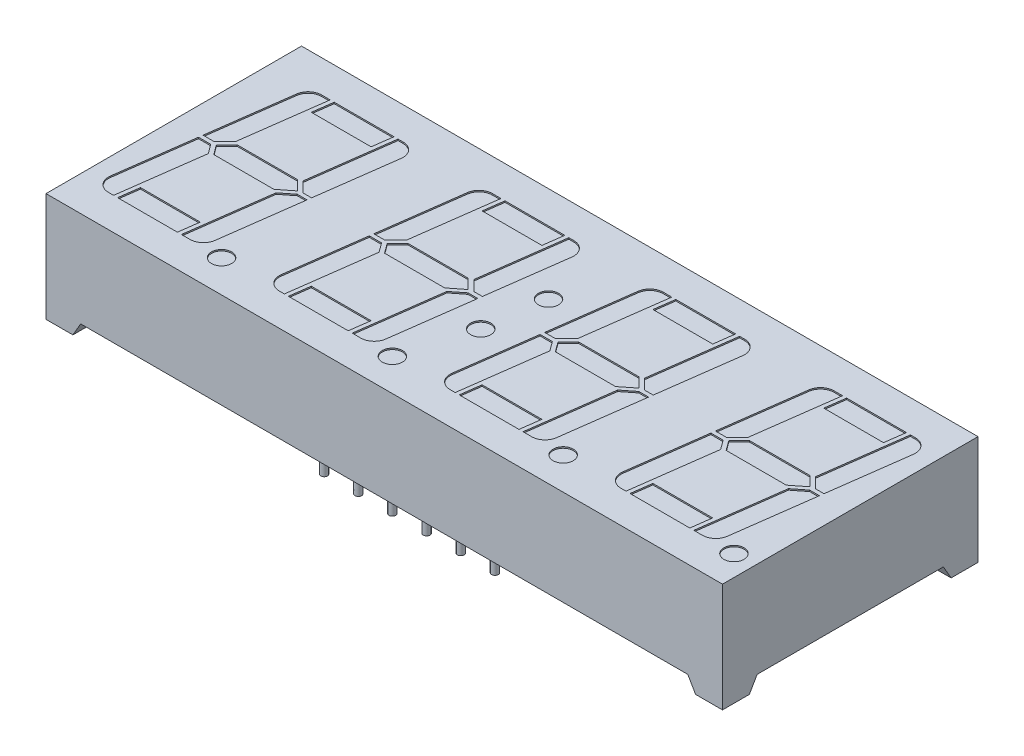
from build123d import *

# Parameters (mm, degrees)
SKETCH_1_W             = 50.3
SKETCH_1_H             = 19
EXTRUDE_1_DEPTH        = 8.1
SKETCH_3_R             = 0.75
CUT_EXTRUDE_1_DEPTH    = 0.1
PATTERN_LINEAR_1_COUNT = 4
PATTERN_LINEAR_1_PITCH = 12.7
SKETCH_4_R             = 0.75
CUT_EXTRUDE_3_DEPTH    = 0.1
CUT_EXTRUDE_4_DEPTH    = 33.54431594
CUT_EXTRUDE_5_DEPTH    = 52.8261517
SKETCH_8_R             = 0.25
EXTRUDE_2_DEPTH        = 2.5
EXTRUDE_2_2_DEPTH      = 2.5
EXTRUDE_2_3_DEPTH      = 2.5
EXTRUDE_2_4_DEPTH      = 2.5
EXTRUDE_2_5_DEPTH      = 2.5
EXTRUDE_2_6_DEPTH      = 2.5
EXTRUDE_2_7_DEPTH      = 2.5
EXTRUDE_2_8_DEPTH      = 2.5
EXTRUDE_2_9_DEPTH      = 2.5
EXTRUDE_2_10_DEPTH     = 2.5
EXTRUDE_2_11_DEPTH     = 2.5
EXTRUDE_2_12_DEPTH     = 2.5


with BuildPart() as part:
    # Эскиз1 → Бобышка-Вытянуть1 (new body)
    with BuildSketch(Plane(origin=(0, 0, 0), x_dir=(1, 0, 0), z_dir=(0, 1, 0))):
        Rectangle(SKETCH_1_W, SKETCH_1_H)
    extrude(amount=EXTRUDE_1_DEPTH)

    # Эскиз3 → Вырез-Вытянуть1 (cut)
    with BuildSketch(Plane(origin=(0, 8.1, 0), x_dir=(1, 0, 0), z_dir=(0, 1, 0))):
        with Locations(Location((-14.494405014, -7.1, 0), (0, 0, 270))):
            Circle(SKETCH_3_R)
        with BuildLine():
            Line((-23.112806327, -0.2), (-22.199326415, -0.2))
            Line((-22.199326415, -0.2), (-21.692447948, -0.893114379))
            Line((-21.692447948, -0.893114379), (-22.526325476, -7.1))
            Line((-22.526325476, -7.1), (-22.896470416, -7.1))
            ThreePointArc((-22.896470416, -7.1), (-23.649182483, -6.758349864), (-23.88756619, -5.966849086))
            Line((-23.88756619, -5.966849086), (-23.112806327, -0.2))
        make_face()
        Polygon((-21.959112688, -0.020255221), (-21.188857467, 0.75), (-16.709621776, 0.75), (-16.56820042, 0.608578644), (-15.977359515, 0.017737739), (-16.953799917, -0.751904222), (-21.425446203, -0.75), align=None)
        Polygon((-20.520116397, 5.6), (-20.31859564, 7.1), (-15.873674524, 7.1), (-16.075195282, 5.6), align=None)
        Polygon((-22.226325476, -7.1), (-22.024804718, -5.6), (-17.579883603, -5.6), (-17.78140436, -7.1), align=None)
        with BuildLine():
            Line((-15.00062839, 0.1), (-15.635357707, 0.1))
            Line((-15.635357707, 0.1), (-16.41002973, 0.874672023))
            Line((-16.41002973, 0.874672023), (-15.573674524, 7.1))
            Line((-15.573674524, 7.1), (-15.203529584, 7.1))
            ThreePointArc((-15.203529584, 7.1), (-14.450817517, 6.758349864), (-14.21243381, 5.966849086))
            Line((-14.21243381, 5.966849086), (-15.00062839, 0.1))
        make_face()
        with BuildLine():
            Line((-15.040932542, -0.2), (-15.676779064, -0.2))
            Line((-15.676779064, -0.2), (-15.768975822, -0.2))
            Line((-15.768975822, -0.2), (-16.64743217, -0.892409762))
            Line((-16.64743217, -0.892409762), (-17.48140436, -7.1))
            Line((-17.48140436, -7.1), (-16.842565077, -7.1))
            ThreePointArc((-16.842565077, -7.1), (-16.184215213, -6.852712068), (-15.851469302, -6.233150914))
            Line((-15.851469302, -6.233150914), (-15.040932542, -0.2))
        make_face()
        with BuildLine():
            Line((-23.072502175, 0.1), (-22.263121535, 0.1))
            Line((-22.263121535, 0.1), (-21.542410857, 0.820710678))
            Line((-21.542410857, 0.820710678), (-21.449751935, 0.9133696))
            Line((-21.449751935, 0.9133696), (-20.61859564, 7.1))
            Line((-20.61859564, 7.1), (-21.257434923, 7.1))
            ThreePointArc((-21.257434923, 7.1), (-21.915784787, 6.852712068), (-22.248530698, 6.233150914))
            Line((-22.248530698, 6.233150914), (-23.072502175, 0.1))
        make_face()
    cut_extrude_1 = extrude(amount=-CUT_EXTRUDE_1_DEPTH, mode=Mode.SUBTRACT)

    # Линейный массив1: Вырез-Вытянуть1 ×4
    with Locations(*[(i * PATTERN_LINEAR_1_PITCH, 0, 0) for i in range(1, PATTERN_LINEAR_1_COUNT)]):
        add(cut_extrude_1, mode=Mode.SUBTRACT)

    # Эскиз4 → Вырез-Вытянуть3 (cut)
    with BuildSketch(Plane(origin=(0, 8.1, 0), x_dir=(1, 0, 0), z_dir=(0, 1, 0))):
        with Locations(Location((0.321440656, 2.392612006, 0), (0, 0, 270))):
            Circle(SKETCH_4_R)
        with Locations(Location((-0.275196222, -2.048396096, 0), (0, 0, 270))):
            Circle(SKETCH_4_R)
    extrude(amount=-CUT_EXTRUDE_3_DEPTH, mode=Mode.SUBTRACT)

    # Эскиз5 → Вырез-Вытянуть4 (cut, through all)
    with BuildSketch(Plane.XY.offset(9.5)):
        Polygon((-23.15, 0), (-22.572649731, 1), (22.572649731, 1), (23.15, 0), align=None)
    extrude(amount=-CUT_EXTRUDE_4_DEPTH, mode=Mode.SUBTRACT)

    # Эскиз6 → Вырез-Вытянуть5 (cut, through all)
    with BuildSketch(Plane(origin=(25.15, 0, 0), x_dir=(0, 0, -1), z_dir=(1, 0, 0))):
        Polygon((-7.5, 0), (-6.922649731, 1), (6.922649731, 1), (7.5, 0), align=None)
    extrude(amount=-CUT_EXTRUDE_5_DEPTH, mode=Mode.SUBTRACT)


with BuildPart() as body_2:
    # Эскиз8 → Бобышка-Вытянуть2 (new body)
    with BuildSketch(Plane.XZ.offset(-1)):
        with Locations(Location((-1.27, -7.62, 0), (0, 0, 270))):
            Circle(SKETCH_8_R)
    extrude(amount=EXTRUDE_2_DEPTH)


with BuildPart() as body_3:
    # Эскиз8 → Extrude 2 2 (new body)
    with BuildSketch(Plane.XZ.offset(-1)):
        with Locations(Location((-3.81, -7.62, 0), (0, 0, 270))):
            Circle(SKETCH_8_R)
    extrude(amount=EXTRUDE_2_2_DEPTH)


with BuildPart() as body_4:
    # Эскиз8 → Extrude 2 3 (new body)
    with BuildSketch(Plane.XZ.offset(-1)):
        with Locations(Location((-6.35, -7.62, 0), (0, 0, 270))):
            Circle(SKETCH_8_R)
    extrude(amount=EXTRUDE_2_3_DEPTH)


with BuildPart() as body_5:
    # Эскиз8 → Extrude 2 4 (new body)
    with BuildSketch(Plane.XZ.offset(-1)):
        with Locations(Location((6.35, -7.62, 0), (0, 0, 90))):
            Circle(SKETCH_8_R)
    extrude(amount=EXTRUDE_2_4_DEPTH)


with BuildPart() as body_6:
    # Эскиз8 → Extrude 2 5 (new body)
    with BuildSketch(Plane.XZ.offset(-1)):
        with Locations(Location((3.81, -7.62, 0), (0, 0, 90))):
            Circle(SKETCH_8_R)
    extrude(amount=EXTRUDE_2_5_DEPTH)


with BuildPart() as body_7:
    # Эскиз8 → Extrude 2 6 (new body)
    with BuildSketch(Plane.XZ.offset(-1)):
        with Locations(Location((1.27, -7.62, 0), (0, 0, 90))):
            Circle(SKETCH_8_R)
    extrude(amount=EXTRUDE_2_6_DEPTH)


with BuildPart() as body_8:
    # Эскиз8 → Extrude 2 7 (new body)
    with BuildSketch(Plane.XZ.offset(-1)):
        with Locations(Location((1.27, 7.62, 0), (0, 0, 270))):
            Circle(SKETCH_8_R)
    extrude(amount=EXTRUDE_2_7_DEPTH)


with BuildPart() as body_9:
    # Эскиз8 → Extrude 2 8 (new body)
    with BuildSketch(Plane.XZ.offset(-1)):
        with Locations(Location((3.81, 7.62, 0), (0, 0, 270))):
            Circle(SKETCH_8_R)
    extrude(amount=EXTRUDE_2_8_DEPTH)


with BuildPart() as body_10:
    # Эскиз8 → Extrude 2 9 (new body)
    with BuildSketch(Plane.XZ.offset(-1)):
        with Locations(Location((6.35, 7.62, 0), (0, 0, 270))):
            Circle(SKETCH_8_R)
    extrude(amount=EXTRUDE_2_9_DEPTH)


with BuildPart() as body_11:
    # Эскиз8 → Extrude 2 10 (new body)
    with BuildSketch(Plane.XZ.offset(-1)):
        with Locations(Location((-6.35, 7.62, 0), (0, 0, 90))):
            Circle(SKETCH_8_R)
    extrude(amount=EXTRUDE_2_10_DEPTH)


with BuildPart() as body_12:
    # Эскиз8 → Extrude 2 11 (new body)
    with BuildSketch(Plane.XZ.offset(-1)):
        with Locations(Location((-3.81, 7.62, 0), (0, 0, 90))):
            Circle(SKETCH_8_R)
    extrude(amount=EXTRUDE_2_11_DEPTH)


with BuildPart() as body_13:
    # Эскиз8 → Extrude 2 12 (new body)
    with BuildSketch(Plane.XZ.offset(-1)):
        with Locations(Location((-1.27, 7.62, 0), (0, 0, 90))):
            Circle(SKETCH_8_R)
    extrude(amount=EXTRUDE_2_12_DEPTH)


solid = Compound([part.part, body_2.part, body_3.part, body_4.part, body_5.part, body_6.part, body_7.part, body_8.part, body_9.part, body_10.part, body_11.part, body_12.part, body_13.part])
